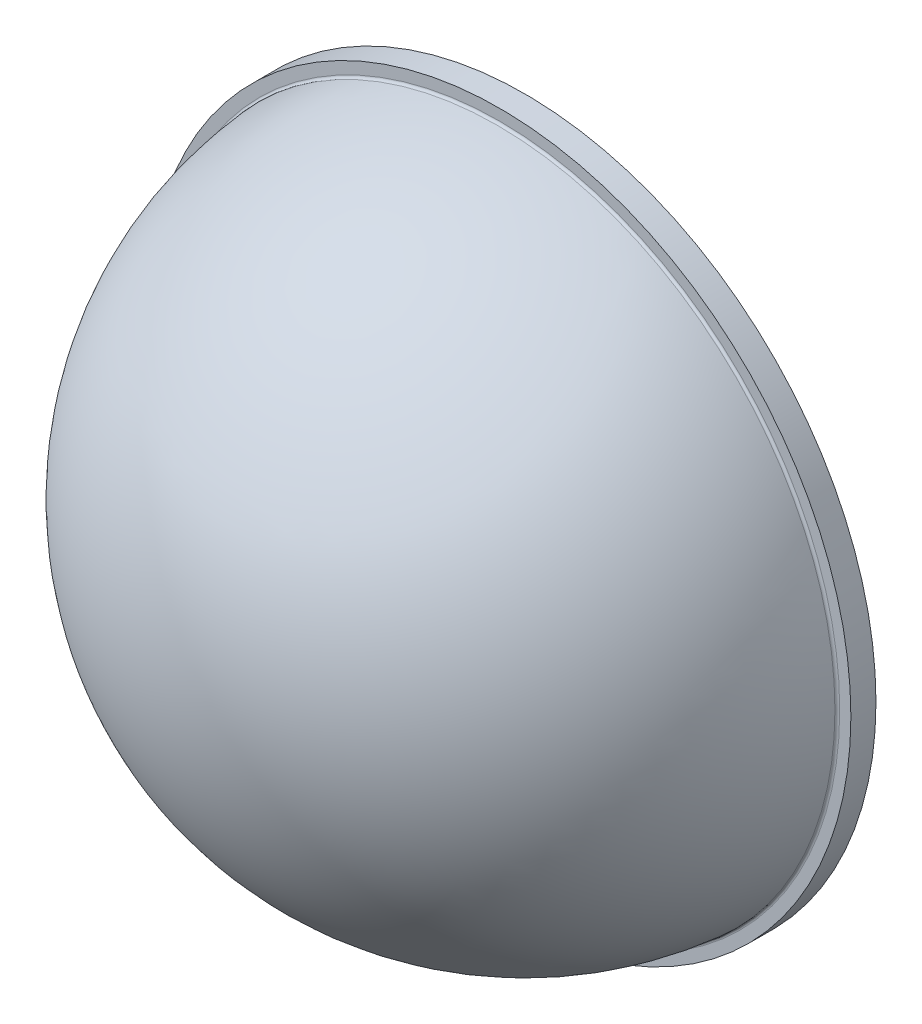
from build123d import *

# Parameters (mm, degrees)
SKETCH1_R           = 70
SKETCH1_R_2         = 65
BOSS_EXTRUDE1_DEPTH = 5
REVOLVE1_ANGLE      = 180
FILLET1_R           = 0.5


with BuildPart() as part:
    # Sketch1 → Boss-Extrude1 (new body)
    with BuildSketch(Plane.XY):
        Circle(SKETCH1_R)
        Circle(SKETCH1_R_2, mode=Mode.SUBTRACT)
    extrude(amount=BOSS_EXTRUDE1_DEPTH)

    # Sketch2 → Revolve1 (revolve)
    with BuildSketch(Plane.XY):
        with BuildLine():
            Line((0, 67.5), (0, 65))
            ThreePointArc((0, 65), (65, 0), (0, -65))
            Line((0, -65), (0, -67.5))
            ThreePointArc((0, -67.5), (67.5, 0), (0, 67.5))
        make_face()
    revolve(axis=Axis((0, 67.5, 0), (0, -1, 0)), revolution_arc=REVOLVE1_ANGLE)

    # Fillet1
    fillet1_edges = [part.edges().sort_by_distance(p)[0] for p in [
        (0, 67.314560089, 5),
        (-65, 0, 0),
    ]]
    fillet(fillet1_edges, radius=FILLET1_R)


solid = part.part
